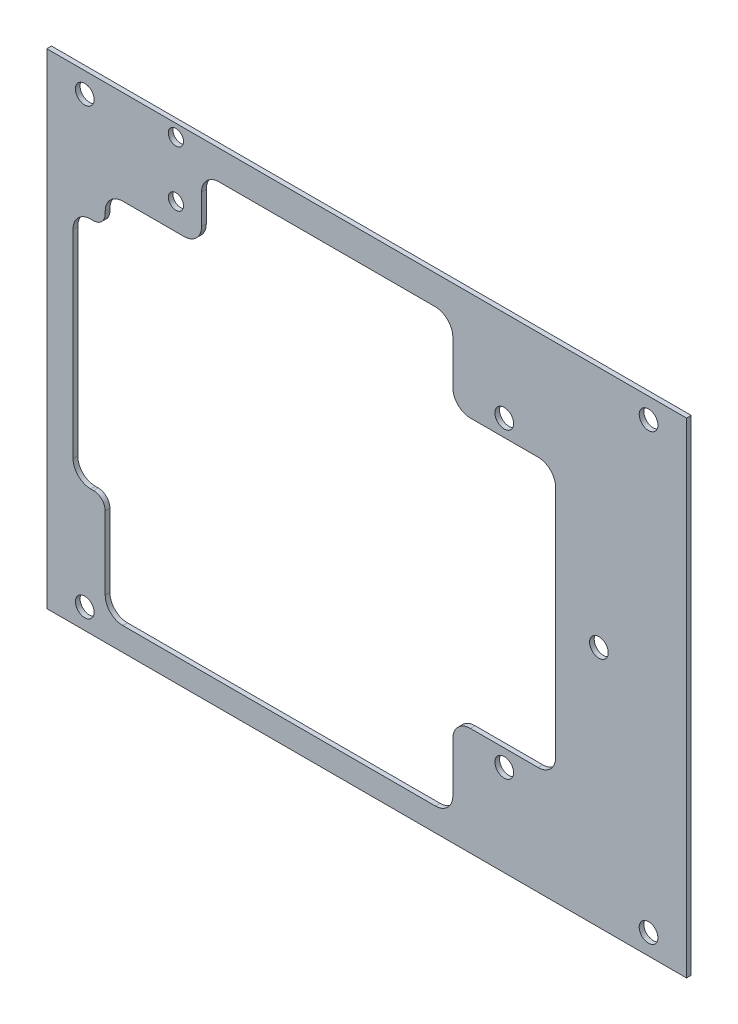
from build123d import *

# Parameters (mm, degrees)
SKETCH1_W           = 109.5
SKETCH1_H           = 83
SKETCH1_R           = 1.6
SKETCH1_R_2         = 1.3
BOSS_EXTRUDE1_DEPTH = 0.8
FILLET1_R           = 3
FILLET2_R           = 2


with BuildPart() as part:
    # Sketch1 → Boss-Extrude1 (new body)
    with BuildSketch(Plane.XY):
        with Locations((0, -41.5)):
            Rectangle(SKETCH1_W, SKETCH1_H)
        with Locations((23.55, -67.375)):
            Circle(SKETCH1_R, mode=Mode.SUBTRACT)
        with Locations((23.55, -15.625)):
            Circle(SKETCH1_R, mode=Mode.SUBTRACT)
        with Locations((48.25, -3.5)):
            Circle(SKETCH1_R, mode=Mode.SUBTRACT)
        with Locations((48.25, -79.5)):
            Circle(SKETCH1_R, mode=Mode.SUBTRACT)
        with Locations((-48.25, -79.5)):
            Circle(SKETCH1_R, mode=Mode.SUBTRACT)
        with Locations((-48.25, -3.5)):
            Circle(SKETCH1_R, mode=Mode.SUBTRACT)
        with Locations((-32.65, -2.07)):
            Circle(SKETCH1_R_2, mode=Mode.SUBTRACT)
        with Locations((-32.65, -11.6)):
            Circle(SKETCH1_R_2, mode=Mode.SUBTRACT)
        with Locations((39.75, -41.5)):
            Circle(SKETCH1_R, mode=Mode.SUBTRACT)
        Polygon((-50.25, -41.5), (-50.25, -61.5), (-44.75, -61.5), (-44.75, -79), (14.75, -79), (14.75, -64.5), (32.35, -64.5), (32.35, -18.5), (14.75, -18.5), (14.75, -5), (-28.25, -5), (-28.25, -16.1), (-44.75, -16.1), (-44.75, -21.5), (-50.25, -21.5), align=None, mode=Mode.SUBTRACT)
    extrude(amount=BOSS_EXTRUDE1_DEPTH)

    # Fillet1
    fillet1_edges = [part.edges().sort_by_distance(p)[0] for p in [
        (32.35, -64.5, 0.4),
        (32.35, -18.5, 0.4),
        (14.75, -18.5, 0.4),
        (14.75, -5, 0.4),
        (-28.25, -5, 0.4),
        (-28.25, -16.1, 0.4),
        (-44.75, -16.1, 0.4),
        (-50.25, -21.5, 0.4),
        (-50.25, -61.5, 0.4),
        (-44.75, -79, 0.4),
        (14.75, -79, 0.4),
        (14.75, -64.5, 0.4),
    ]]
    fillet(fillet1_edges, radius=FILLET1_R)

    # Fillet2
    fillet2_edges = [part.edges().sort_by_distance(p)[0] for p in [
        (-44.75, -21.5, 0.4),
        (-44.75, -61.5, 0.4),
    ]]
    fillet(fillet2_edges, radius=FILLET2_R)


solid = part.part
